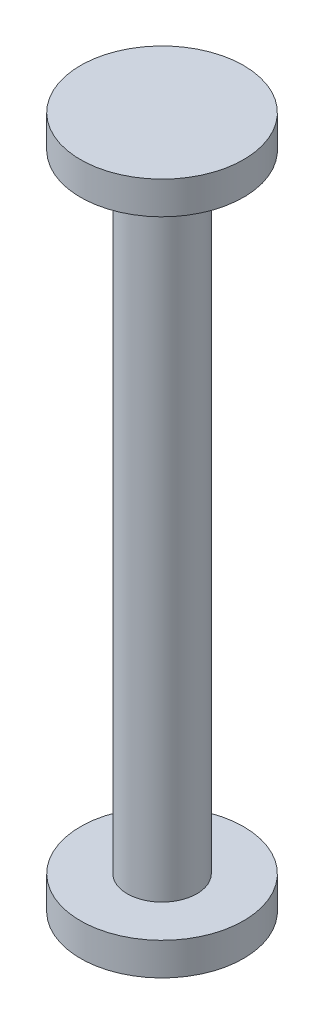
from build123d import *

# Parameters (mm, degrees)
SKETCH1_R           = 9.525
BOSS_EXTRUDE1_DEPTH = 3.81
SKETCH2_R           = 4.064
BOSS_EXTRUDE2_DEPTH = 73.152
SKETCH3_R           = 9.525
BOSS_EXTRUDE3_DEPTH = 3.81


with BuildPart() as part:
    # Sketch1 → Boss-Extrude1 (new body)
    with BuildSketch(Plane(origin=(0, 0, 0), x_dir=(1, 0, 0), z_dir=(0, 1, 0))):
        with Locations(Location((0, 0, 0), (0, 0, 90))):
            Circle(SKETCH1_R)
    extrude(amount=BOSS_EXTRUDE1_DEPTH)

    # Sketch2 → Boss-Extrude2 (add)
    with BuildSketch(Plane(origin=(0, 3.81, 0), x_dir=(1, 0, 0), z_dir=(0, 1, 0))):
        with Locations(Location((0, 0, 0), (0, 0, 270))):
            Circle(SKETCH2_R)
    extrude(amount=BOSS_EXTRUDE2_DEPTH)

    # Sketch3 → Boss-Extrude3 (add)
    with BuildSketch(Plane(origin=(0, 76.962, 0), x_dir=(1, 0, 0), z_dir=(0, 1, 0))):
        with Locations(Location((0, 0, 0), (0, 0, 90))):
            Circle(SKETCH3_R)
    extrude(amount=BOSS_EXTRUDE3_DEPTH)


solid = part.part
